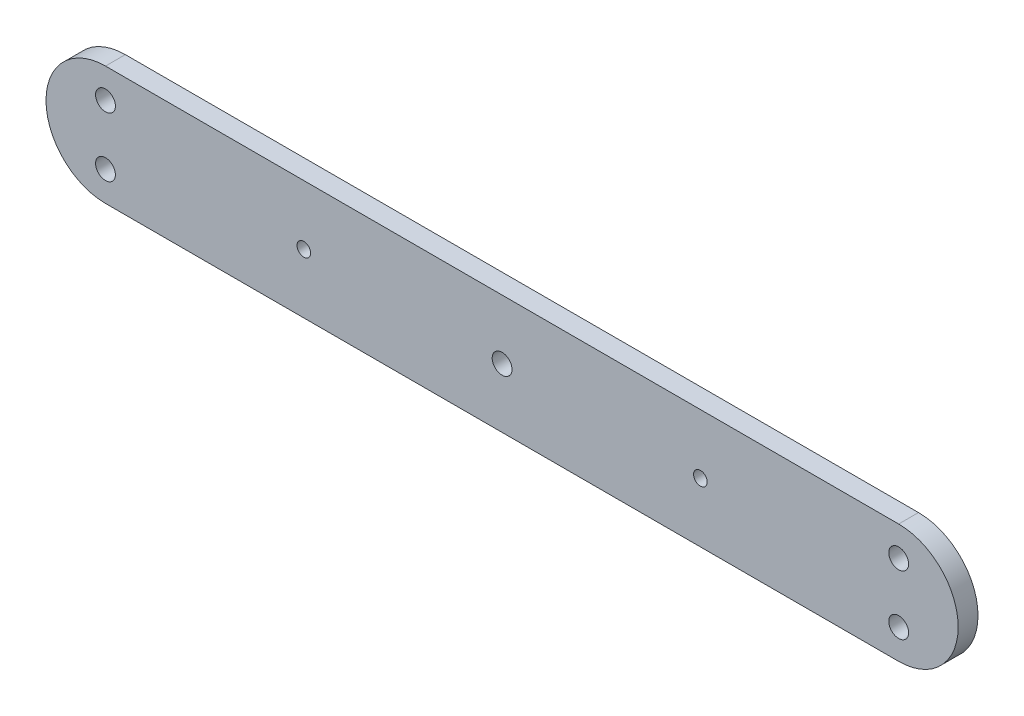
from build123d import *

# Parameters (mm, degrees)
SKETCH1_R           = 3.175
SKETCH1_R_2         = 2.1828125
BOSS_EXTRUDE1_DEPTH = 6.35


with BuildPart() as part:
    # Sketch1 → Boss-Extrude1 (new body)
    with BuildSketch(Plane.XY):
        with BuildLine():
            Line((-89.243243243, 19.05), (164.756756757, 19.05))
            ThreePointArc((164.756756757, 19.05), (183.806756757, 0), (164.756756757, -19.05))
            Line((164.756756757, -19.05), (-89.243243243, -19.05))
            ThreePointArc((-89.243243243, -19.05), (-108.293243243, 0), (-89.243243243, 19.05))
        make_face()
        with Locations((37.756756757, 0)):
            Circle(SKETCH1_R, mode=Mode.SUBTRACT)
        with Locations((-25.743243243, 0)):
            Circle(SKETCH1_R_2, mode=Mode.SUBTRACT)
        with Locations((101.256756757, 0)):
            Circle(SKETCH1_R_2, mode=Mode.SUBTRACT)
        with Locations((164.756756757, -9.525)):
            Circle(SKETCH1_R, mode=Mode.SUBTRACT)
        with Locations((164.756756757, 9.525)):
            Circle(SKETCH1_R, mode=Mode.SUBTRACT)
        with Locations((-89.243243243, 9.525)):
            Circle(SKETCH1_R, mode=Mode.SUBTRACT)
        with Locations((-89.243243243, -9.525)):
            Circle(SKETCH1_R, mode=Mode.SUBTRACT)
    extrude(amount=BOSS_EXTRUDE1_DEPTH)


solid = part.part
